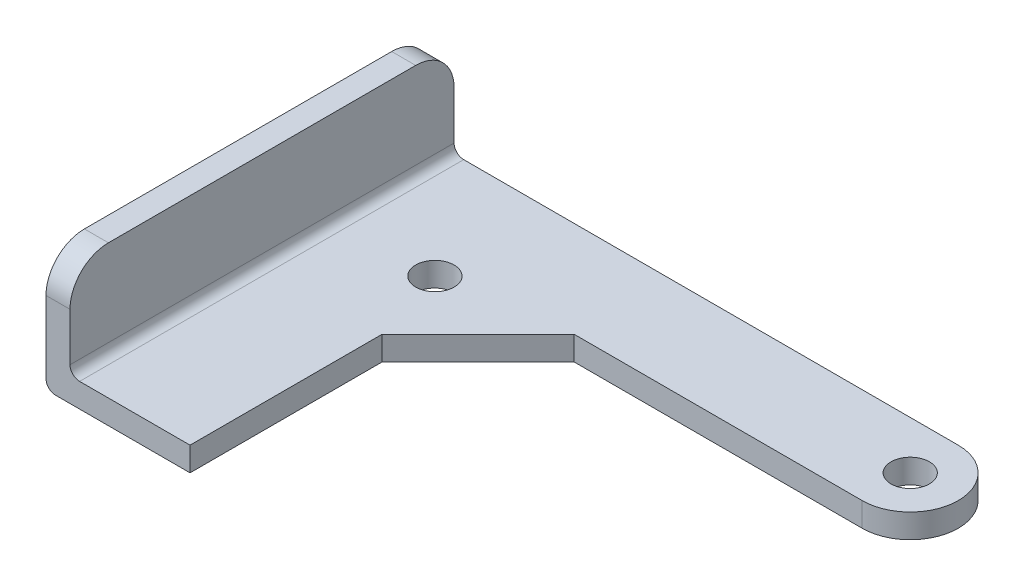
from build123d import *

# Parameters (mm, degrees)
SKETCH1_R           = 20
BOSS_EXTRUDE1_DEPTH = 12.5
SKETCH2_W           = 25
SKETCH2_H           = 400
BOSS_EXTRUDE2_DEPTH = 100
CUT_EXTRUDE2_DEPTH  = 730.83302885
FILLET1_R           = 10


with BuildPart() as part:
    # Sketch1 → Boss-Extrude1 (new, symmetric)
    with BuildSketch(Plane(origin=(0, 0, 0), x_dir=(1, 0, 0), z_dir=(0, 1, 0))):
        with BuildLine():
            Line((0, 0), (550, 0))
            ThreePointArc((550, 0), (600, -50), (550, -100))
            Line((550, -100), (250, -100))
            Line((250, -100), (150, -200))
            Line((150, -200), (150, -400))
            Line((150, -400), (0, -400))
            Line((0, -400), (0, 0))
        make_face()
        with Locations(Location((550, -50, 0), (0, 0, 270))):
            Circle(SKETCH1_R, mode=Mode.SUBTRACT)
        with Locations(Location((125, -120, 0), (0, 0, 270))):
            Circle(SKETCH1_R, mode=Mode.SUBTRACT)
    extrude(amount=BOSS_EXTRUDE1_DEPTH, both=True)

    # Sketch2 → Boss-Extrude2 (add)
    with BuildSketch(Plane(origin=(0, 12.5, 0), x_dir=(1, 0, 0), z_dir=(0, 1, 0))):
        with Locations((12.5, -200)):
            Rectangle(SKETCH2_W, SKETCH2_H)
    extrude(amount=BOSS_EXTRUDE2_DEPTH)

    # Sketch3 → Cut-Extrude2 (cut, through all)
    with BuildSketch(Plane.ZY):
        with BuildLine():
            Line((0, 112.5), (0, 72.5))
            ThreePointArc((0, 72.5), (11.715728753, 100.784271247), (40, 112.5))
            Line((40, 112.5), (0, 112.5))
        make_face()
        with BuildLine():
            Line((400, 112.5), (360, 112.5))
            ThreePointArc((360, 112.5), (388.284271247, 100.784271247), (400, 72.5))
            Line((400, 72.5), (400, 112.5))
        make_face()
    extrude(amount=-CUT_EXTRUDE2_DEPTH, mode=Mode.SUBTRACT)

    # Fillet1
    fillet1_edges = [part.edges().sort_by_distance(p)[0] for p in [
        (0, -12.5, 200),
        (25, 12.5, 200),
    ]]
    fillet(fillet1_edges, radius=FILLET1_R)


solid = part.part
